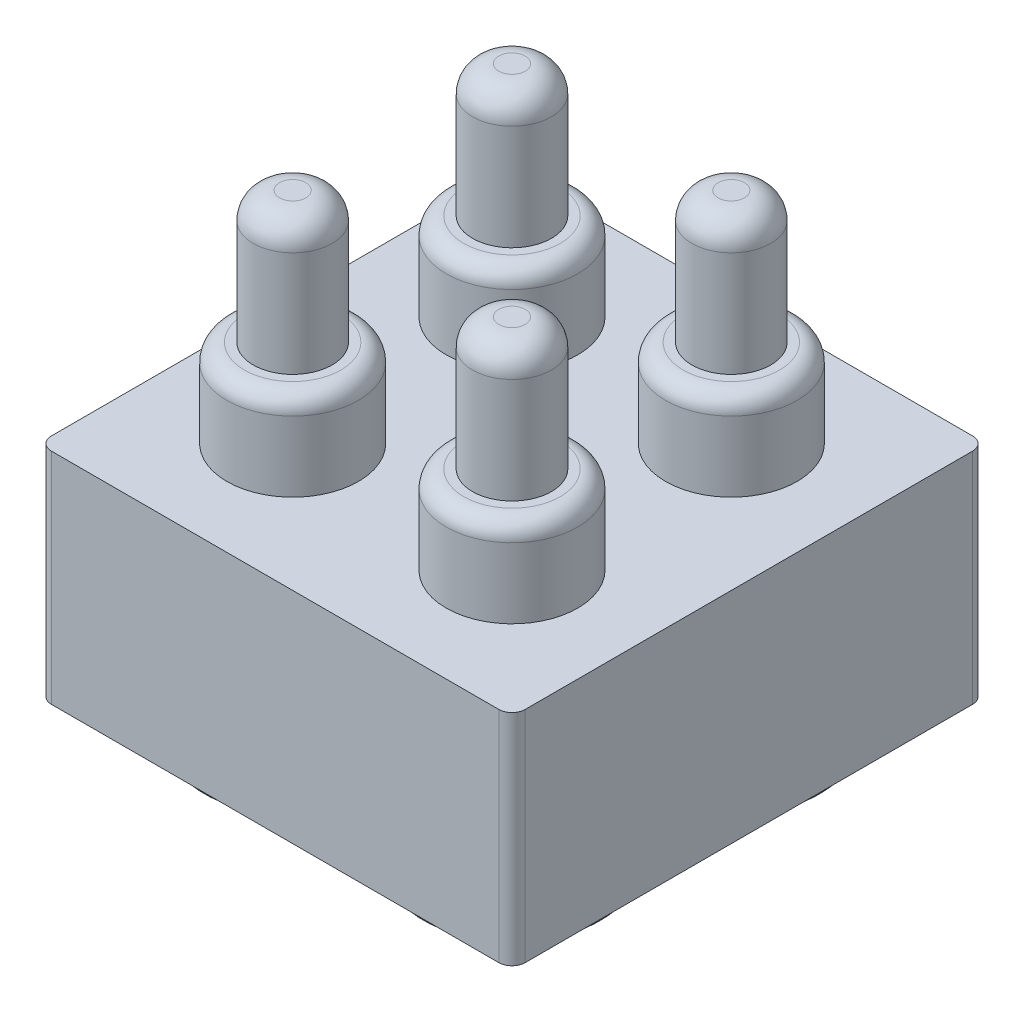
from build123d import *

# Parameters (mm, degrees)
SKETCH_1_W        = 5.4
SKETCH_1_H        = 5.4
EXTRUDE_1_DEPTH   = 2.5
SKETCH_2_R        = 0.75
EXTRUDE_2_DEPTH   = 1
EXTRUDE_2_2_DEPTH = 1
EXTRUDE_2_3_DEPTH = 1
EXTRUDE_2_4_DEPTH = 1
SKETCH_3_R        = 0.45
EXTRUDE_3_DEPTH   = 1.5
FILLET_2_R        = 0.2
FILLET_3_R        = 0.2
FILLET_4_R        = 0.2
FILLET_5_R        = 0.2
FILLET_6_R        = 0.3
FILLET_7_R        = 0.3
FILLET_8_R        = 0.3
FILLET_9_R        = 0.3
SKETCH_4_R        = 1.05
EXTRUDE_4_DEPTH   = 0.5
EXTRUDE_4_2_DEPTH = 0.5
EXTRUDE_4_3_DEPTH = 0.5
EXTRUDE_4_4_DEPTH = 0.5
FILLET_10_R       = 0.15
FILLET_11_R       = 0.15
FILLET_12_R       = 0.15
FILLET_13_R       = 0.15
FILLET_14_R       = 0.15


with BuildPart() as part:
    # 草图1 → 凸台-拉伸1 (new body)
    with BuildSketch(Plane(origin=(0, 0, 0), x_dir=(1, 0, 0), z_dir=(0, 1, 0))):
        Rectangle(SKETCH_1_W, SKETCH_1_H)
    extrude(amount=EXTRUDE_1_DEPTH)

    # 圆角14
    fillet_14_edges = [part.edges().sort_by_distance(p)[0] for p in [
        (2.7, 1.25, 2.7),
        (-2.7, 1.25, 2.7),
        (-2.7, 1.25, -2.7),
        (2.7, 1.25, -2.7),
    ]]
    fillet(fillet_14_edges, radius=FILLET_14_R)


with BuildPart() as body_2:
    # 草图2 → 凸台-拉伸2 (new body)
    with BuildSketch(Plane(origin=(0, 2.5, 0), x_dir=(1, 0, 0), z_dir=(0, 1, 0))):
        with Locations(Location((-1.25, 1.25, 0), (0, 0, 270))):
            Circle(SKETCH_2_R)
    extrude(amount=EXTRUDE_2_DEPTH)



with BuildPart() as body_3:
    # 草图2 → Extrude 2 2 (new body)
    with BuildSketch(Plane(origin=(0, 2.5, 0), x_dir=(1, 0, 0), z_dir=(0, 1, 0))):
        with Locations(Location((1.25, 1.25, 0), (0, 0, 270))):
            Circle(SKETCH_2_R)
    extrude(amount=EXTRUDE_2_2_DEPTH)


with BuildPart() as body_4:
    # 草图2 → Extrude 2 3 (new body)
    with BuildSketch(Plane(origin=(0, 2.5, 0), x_dir=(1, 0, 0), z_dir=(0, 1, 0))):
        with Locations(Location((-1.25, -1.25, 0), (0, 0, 270))):
            Circle(SKETCH_2_R)
    extrude(amount=EXTRUDE_2_3_DEPTH)


with BuildPart() as body_5:
    # 草图2 → Extrude 2 4 (new body)
    with BuildSketch(Plane(origin=(0, 2.5, 0), x_dir=(1, 0, 0), z_dir=(0, 1, 0))):
        with Locations(Location((1.25, -1.25, 0), (0, 0, 270))):
            Circle(SKETCH_2_R)
    extrude(amount=EXTRUDE_2_4_DEPTH)


with BuildPart() as body_2_1:
    add(body_2.part)

    add(body_3.part)  # 凸台-拉伸3 merges body 3

    add(body_4.part)  # 凸台-拉伸3 merges body 4

    add(body_5.part)  # 凸台-拉伸3 merges body 5
    # 草图3 → 凸台-拉伸3 (add)
    with BuildSketch(Plane(origin=(0, 3.5, 0), x_dir=(1, 0, 0), z_dir=(0, 1, 0))):
        with Locations(Location((-1.25, 1.25, 0), (0, 0, 270))):
            Circle(SKETCH_3_R)
        with Locations(Location((1.25, 1.25, 0), (0, 0, 90))):
            Circle(SKETCH_3_R)
        with Locations(Location((1.25, -1.25, 0), (0, 0, 270))):
            Circle(SKETCH_3_R)
        with Locations(Location((-1.25, -1.25, 0), (0, 0, 90))):
            Circle(SKETCH_3_R)
    extrude(amount=EXTRUDE_3_DEPTH)

    # 圆角2
    fillet_2_edges = [body_2_1.edges().sort_by_distance(p)[0] for p in [
        (-1.25, 3.5, -2),
    ]]
    fillet(fillet_2_edges, radius=FILLET_2_R)

    # 圆角3
    fillet_3_edges = [body_2_1.edges().sort_by_distance(p)[0] for p in [
        (1.25, 3.5, -2),
    ]]
    fillet(fillet_3_edges, radius=FILLET_3_R)

    # 圆角4
    fillet_4_edges = [body_2_1.edges().sort_by_distance(p)[0] for p in [
        (1.25, 3.5, 0.5),
    ]]
    fillet(fillet_4_edges, radius=FILLET_4_R)

    # 圆角5
    fillet_5_edges = [body_2_1.edges().sort_by_distance(p)[0] for p in [
        (-1.25, 3.5, 0.5),
    ]]
    fillet(fillet_5_edges, radius=FILLET_5_R)

    # 圆角6
    fillet_6_edges = [body_2_1.edges().sort_by_distance(p)[0] for p in [
        (-1.25, 5, -1.7),
    ]]
    fillet(fillet_6_edges, radius=FILLET_6_R)

    # 圆角7
    fillet_7_edges = [body_2_1.edges().sort_by_distance(p)[0] for p in [
        (1.25, 5, -0.8),
    ]]
    fillet(fillet_7_edges, radius=FILLET_7_R)

    # 圆角8
    fillet_8_edges = [body_2_1.edges().sort_by_distance(p)[0] for p in [
        (1.25, 5, 0.8),
    ]]
    fillet(fillet_8_edges, radius=FILLET_8_R)

    # 圆角9
    fillet_9_edges = [body_2_1.edges().sort_by_distance(p)[0] for p in [
        (-1.25, 5, 1.7),
    ]]
    fillet(fillet_9_edges, radius=FILLET_9_R)


with BuildPart() as body_3_2:
    # 草图4 → 凸台-拉伸4 (new body)
    with BuildSketch(Plane.XZ):
        with Locations(Location((-1.25, 1.25, 0), (0, 0, 270))):
            Circle(SKETCH_4_R)
    extrude(amount=EXTRUDE_4_DEPTH)

    # 圆角10
    fillet_10_edges = [body_3_2.edges().sort_by_distance(p)[0] for p in [
        (-1.25, -0.5, 2.3),
    ]]
    fillet(fillet_10_edges, radius=FILLET_10_R)


with BuildPart() as body_4_2:
    # 草图4 → Extrude 4 2 (new body)
    with BuildSketch(Plane.XZ):
        with Locations(Location((1.25, 1.25, 0), (0, 0, 270))):
            Circle(SKETCH_4_R)
    extrude(amount=EXTRUDE_4_2_DEPTH)

    # 圆角11
    fillet_11_edges = [body_4_2.edges().sort_by_distance(p)[0] for p in [
        (1.25, -0.5, 2.3),
    ]]
    fillet(fillet_11_edges, radius=FILLET_11_R)


with BuildPart() as body_5_2:
    # 草图4 → Extrude 4 3 (new body)
    with BuildSketch(Plane.XZ):
        with Locations(Location((1.25, -1.25, 0), (0, 0, 270))):
            Circle(SKETCH_4_R)
    extrude(amount=EXTRUDE_4_3_DEPTH)

    # 圆角13
    fillet_13_edges = [body_5_2.edges().sort_by_distance(p)[0] for p in [
        (1.25, -0.5, -0.2),
    ]]
    fillet(fillet_13_edges, radius=FILLET_13_R)


with BuildPart() as body_6:
    # 草图4 → Extrude 4 4 (new body)
    with BuildSketch(Plane.XZ):
        with Locations(Location((-1.25, -1.25, 0), (0, 0, 270))):
            Circle(SKETCH_4_R)
    extrude(amount=EXTRUDE_4_4_DEPTH)

    # 圆角12
    fillet_12_edges = [body_6.edges().sort_by_distance(p)[0] for p in [
        (-1.25, -0.5, -0.2),
    ]]
    fillet(fillet_12_edges, radius=FILLET_12_R)


solid = Compound([part.part, body_2_1.part, body_3_2.part, body_4_2.part, body_5_2.part, body_6.part])
